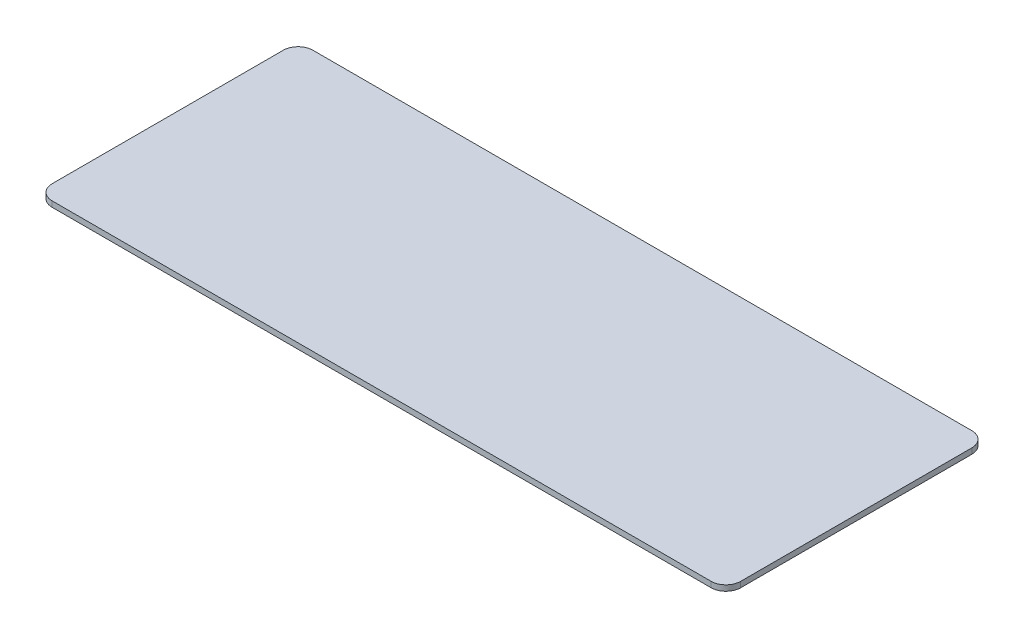
from build123d import *

# Parameters (mm, degrees)
SKETCH1_W           = 368.271
SKETCH1_H           = 139.4902
BOSS_EXTRUDE1_DEPTH = 1.5
FILLET1_R           = 7.9375


with BuildPart() as part:
    # Sketch1 → Boss-Extrude1 (new, symmetric)
    with BuildSketch(Plane(origin=(0, 0, 0), x_dir=(1, 0, 0), z_dir=(0, 1, 0))):
        Rectangle(SKETCH1_W, SKETCH1_H)
    extrude(amount=BOSS_EXTRUDE1_DEPTH, both=True)

    # Fillet1
    fillet1_edges = [part.edges().sort_by_distance(p)[0] for p in [
        (184.1355, 0, 69.7451),
        (-184.1355, 0, 69.7451),
        (-184.1355, 0, -69.7451),
        (184.1355, 0, -69.7451),
    ]]
    fillet(fillet1_edges, radius=FILLET1_R)


solid = part.part
